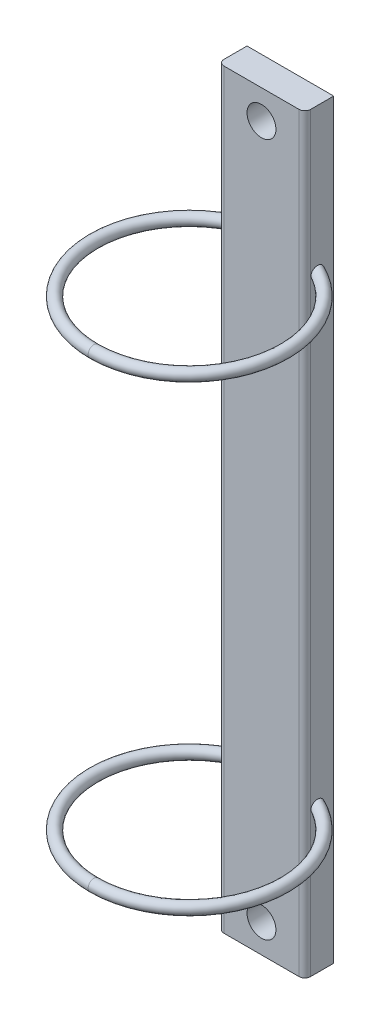
from build123d import *

# Parameters (mm, degrees)
SKETCH_1_W        = 15
SKETCH_1_H        = 130
SKETCH_1_R        = 2.5
EXTRUDE_1_DEPTH   = 5
SWEEP_2_PROFILE_R = 1
FILLET_1_R        = 1


with BuildPart() as part:
    # Эскиз1 → Бобышка-Вытянуть1 (new body)
    with BuildSketch(Plane.XY):
        Rectangle(SKETCH_1_W, SKETCH_1_H)
        with Locations((0, 60)):
            Circle(SKETCH_1_R, mode=Mode.SUBTRACT)
        with Locations(Location((0, -60, 0), (0, 0, 180))):
            Circle(SKETCH_1_R, mode=Mode.SUBTRACT)
    extrude(amount=EXTRUDE_1_DEPTH)

    # По траектории2: sweep along a path in Эскиз28
    with BuildLine(Plane(origin=(0, 40, 0), x_dir=(1, 0, 0), z_dir=(0, 1, 0))) as sweep_2_path:
        CenterArc((0, -17.5), 16.5, 0, 360)
    # По траектории2 profile (on start of the path) → По траектории2 (sweep)
    with BuildSketch(Plane(origin=(16.5, 40, 17.5), x_dir=(-1, 0, 0), z_dir=(0, 0, -1))):
        Circle(SWEEP_2_PROFILE_R)
    sweep_2 = sweep(path=sweep_2_path.line)

    # Скругление1
    fillet_1_edges = [part.edges().sort_by_distance(p)[0] for p in [
        (-7.5, 0, 5),
        (7.5, 0, 5),
    ]]
    fillet(fillet_1_edges, radius=FILLET_1_R)

    # Зеркальное отражение1: По траектории2 across plane
    add(sweep_2.mirror(Plane.ZX))


solid = part.part
